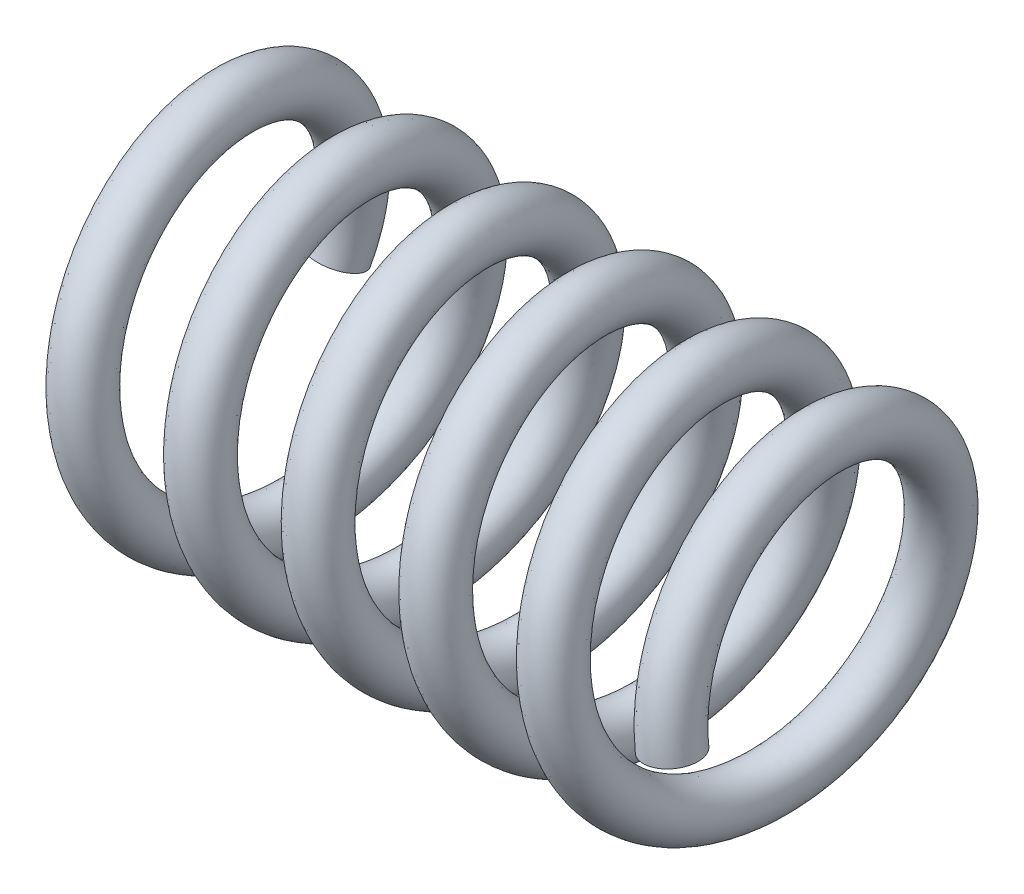
from build123d import *

# Parameters (mm, degrees)
SWEEP1_PITCH       = 9
SWEEP1_HEIGHT      = 50
SWEEP1_RADIUS      = 12.5
SWEEP1_START_ANGLE = 180
SWEEP1_PROFILE_R   = 2


with BuildPart() as part:
    # Sweep1: sweep along a helix
    with BuildLine() as sweep1_path:
        add(Helix(SWEEP1_PITCH, SWEEP1_HEIGHT, SWEEP1_RADIUS, center=(0, 0, 0), direction=(-1, 0, 0), mode=Mode.PRIVATE).rotate(Axis((0, 0, 0), (-1, 0, 0)), SWEEP1_START_ANGLE))
    # Sweep1 profile (on start of the path) → Sweep1 (sweep)
    with BuildSketch(Plane(origin=(0, 0, 12.5), x_dir=(0.9934983486759255, 0.11384652466460886, 0), z_dir=(-0.11384652466460886, 0.9934983486759255, 3.2656935227799883e-13))):
        Circle(SWEEP1_PROFILE_R)
    sweep(path=sweep1_path.line, is_frenet=True)


solid = part.part
